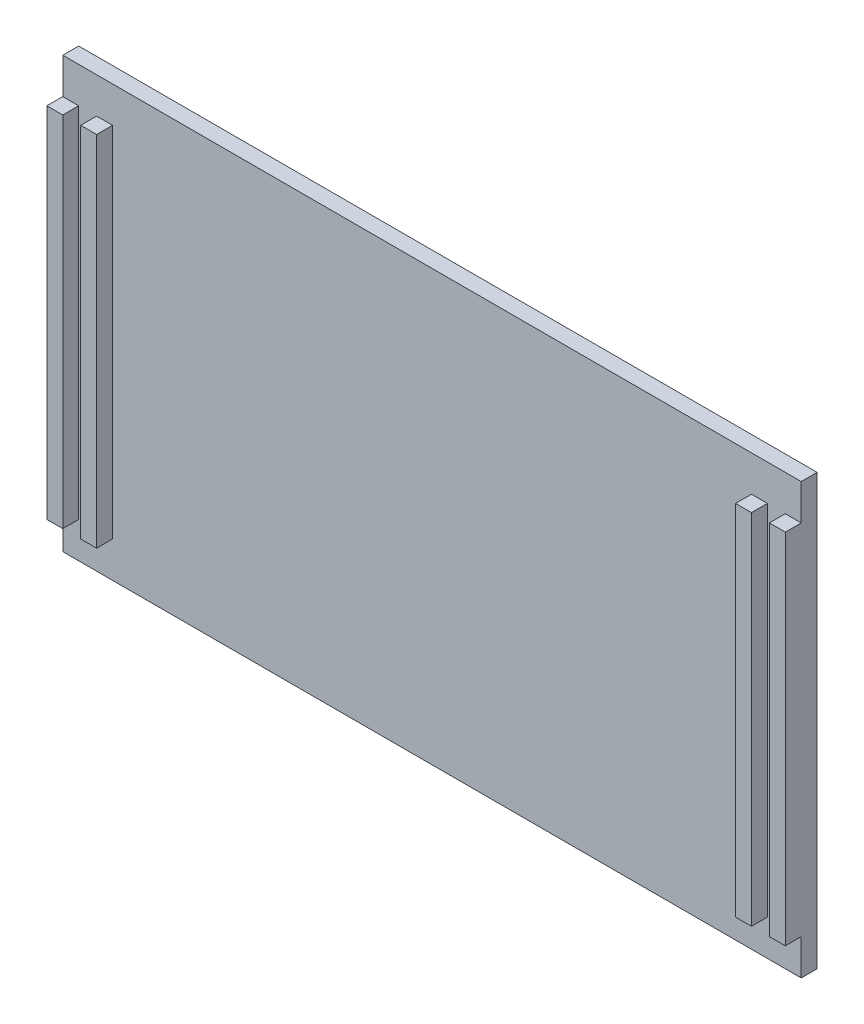
from build123d import *

# Parameters (mm, degrees)
BOSS_EXTRUDE1_DEPTH = 54
SKETCH7_W           = 185.5
SKETCH7_H           = 9
CUT_EXTRUDE4_DEPTH  = 4
SKETCH8_W           = 185.5
SKETCH8_H           = 9
CUT_EXTRUDE5_DEPTH  = 4


with BuildPart() as part:
    # Sketch1 → Boss-Extrude1 (new, symmetric)
    with BuildSketch(Plane(origin=(0, 0, 0), x_dir=(1, 0, 0), z_dir=(0, 1, 0))):
        Polygon((-63.408892702, 20.487993735), (122.091107298, 20.487993735), (122.091107298, 12.487993735), (118.091107298, 12.487993735), (118.091107298, 16.487993735), (113.591107298, 16.487993735), (113.591107298, 12.487993735), (109.591107298, 12.487993735), (109.591107298, 16.487993735), (-50.908892702, 16.487993735), (-50.908892702, 12.487993735), (-54.908892702, 12.487993735), (-54.908892702, 16.487993735), (-59.408892702, 16.487993735), (-59.408892702, 12.487993735), (-63.408892702, 12.487993735), align=None)
    extrude(amount=BOSS_EXTRUDE1_DEPTH, both=True)

    # Sketch7 → Cut-Extrude4 (cut)
    with BuildSketch(Plane.XY.offset(-12.487993735)):
        with Locations((29.341107298, 49.5)):
            Rectangle(SKETCH7_W, SKETCH7_H)
    extrude(amount=-CUT_EXTRUDE4_DEPTH, mode=Mode.SUBTRACT)

    # Sketch8 → Cut-Extrude5 (cut)
    with BuildSketch(Plane.XY.offset(-12.487993735)):
        with Locations((29.341107298, -49.5)):
            Rectangle(SKETCH8_W, SKETCH8_H)
    extrude(amount=-CUT_EXTRUDE5_DEPTH, mode=Mode.SUBTRACT)


solid = part.part
